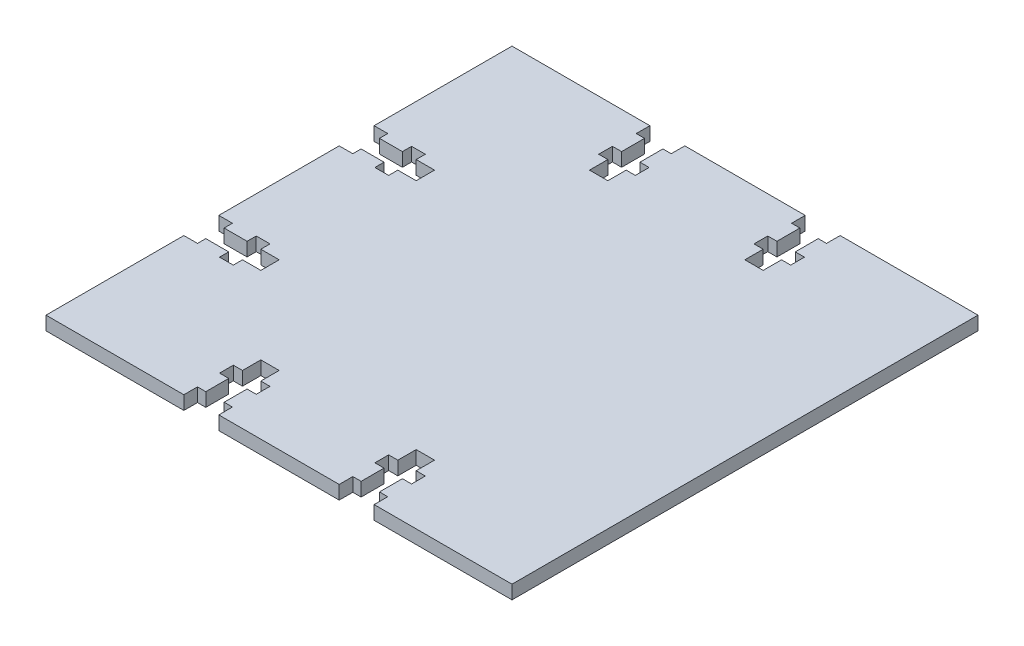
from build123d import *

# Parameters (mm, degrees)
SKETCH_1_W            = 101.6
SKETCH_1_H            = 101.6
EXTRUDE_1_DEPTH       = 2.9718
CUT_EXTRUDE_1_DEPTH   = 144.714827333
MIRROR_2_COPY_1_DEPTH = 144.714827333
CUT_EXTRUDE_3_DEPTH   = 144.714827333


with BuildPart() as part:
    # 草图1 → 凸台-拉伸1 (new body)
    with BuildSketch(Plane(origin=(0, 0, 0), x_dir=(1, 0, 0), z_dir=(0, 1, 0))):
        with Locations((50.8, 50.8)):
            Rectangle(SKETCH_1_W, SKETCH_1_H)
    extrude(amount=EXTRUDE_1_DEPTH)

    # 草图1<3> → 切除-拉伸1 (cut, through all)
    with BuildSketch(Plane(origin=(0, 0, 0), x_dir=(1, 0, 0), z_dir=(0, 1, 0))):
        Polygon((37.676666667, 98.6282), (37.676666667, 101.6), (30.056666667, 101.6), (30.056666667, 98.6282), (31.866666667, 98.6282), (31.866666667, 93.6282), (29.866666667, 93.6282), (29.866666667, 90.6282), (31.866666667, 90.6282), (31.866666667, 86.6282), (35.866666667, 86.6282), (35.866666667, 90.6282), (37.866666667, 90.6282), (37.866666667, 93.6282), (35.866666667, 93.6282), (35.866666667, 98.6282), align=None)
    cut_extrude_1 = extrude(amount=CUT_EXTRUDE_1_DEPTH, mode=Mode.SUBTRACT)

    # 镜向1: 切除-拉伸1 across plane
    add(cut_extrude_1.mirror(Plane(origin=(0, 0, -50.8), x_dir=(1, 0, 0), z_dir=(0, 0, -1))), mode=Mode.SUBTRACT)

    # 镜向2: 切除-拉伸1 across plane
    add(cut_extrude_1.mirror(Plane(origin=(50.8, 0, 0), x_dir=(0, 0, 1), z_dir=(1, 0, 0))), mode=Mode.SUBTRACT)

    # 镜向2 copy 1 sketch → 镜向2 copy 1 (cut, through all)
    with BuildSketch(Plane(origin=(101.6, 0, -101.6), x_dir=(-1, 0, 0), z_dir=(0, 1, 0))):
        Polygon((37.676666667, 98.6282), (37.676666667, 101.6), (30.056666667, 101.6), (30.056666667, 98.6282), (31.866666667, 98.6282), (31.866666667, 93.6282), (29.866666667, 93.6282), (29.866666667, 90.6282), (31.866666667, 90.6282), (31.866666667, 86.6282), (35.866666667, 86.6282), (35.866666667, 90.6282), (37.866666667, 90.6282), (37.866666667, 93.6282), (35.866666667, 93.6282), (35.866666667, 98.6282), align=None)
    extrude(amount=MIRROR_2_COPY_1_DEPTH, mode=Mode.SUBTRACT)

    # 草图1<4> → 切除-拉伸3 (cut, through all)
    with BuildSketch(Plane(origin=(0, 0, 0), x_dir=(1, 0, 0), z_dir=(0, 1, 0))):
        Polygon((0, 71.543333333), (0, 63.923333333), (2.9718, 63.923333333), (2.9718, 65.733333333), (7.9718, 65.733333333), (7.9718, 63.733333333), (10.9718, 63.733333333), (10.9718, 65.733333333), (14.9718, 65.733333333), (14.9718, 69.733333333), (10.9718, 69.733333333), (10.9718, 71.733333333), (7.9718, 71.733333333), (7.9718, 69.733333333), (2.9718, 69.733333333), (2.9718, 71.543333333), align=None)
    cut_extrude_3 = extrude(amount=CUT_EXTRUDE_3_DEPTH, mode=Mode.SUBTRACT)

    # 镜向3: 切除-拉伸3 across plane
    add(cut_extrude_3.mirror(Plane(origin=(0, 0, -50.8), x_dir=(1, 0, 0), z_dir=(0, 0, -1))), mode=Mode.SUBTRACT)


solid = part.part
